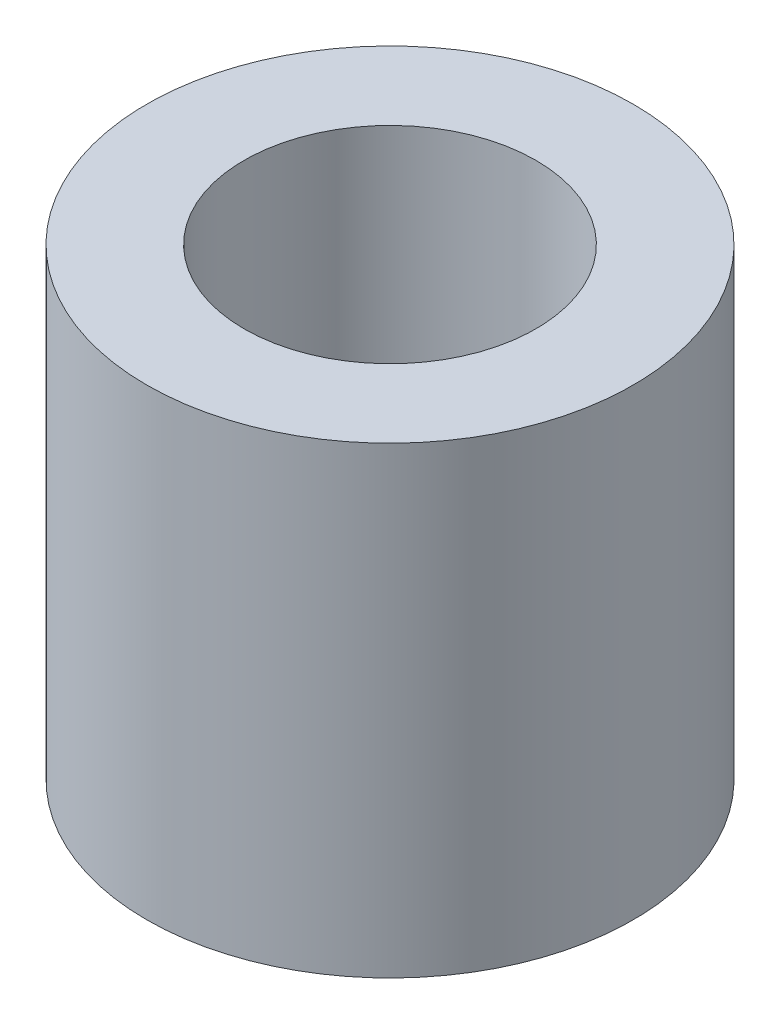
from build123d import *

# Parameters (mm, degrees)
SKETCH1_R           = 2.5
SKETCH1_R_2         = 1.5
BOSS_EXTRUDE1_DEPTH = 4.76


with BuildPart() as part:
    # Sketch1 → Boss-Extrude1 (new body)
    with BuildSketch(Plane(origin=(0, 0, 0), x_dir=(1, 0, 0), z_dir=(0, 1, 0))):
        with Locations(Location((0, 0, 0), (0, 0, 270))):
            Circle(SKETCH1_R)
        with Locations(Location((0, 0, 0), (0, 0, 270))):
            Circle(SKETCH1_R_2, mode=Mode.SUBTRACT)
    extrude(amount=BOSS_EXTRUDE1_DEPTH)


solid = part.part
